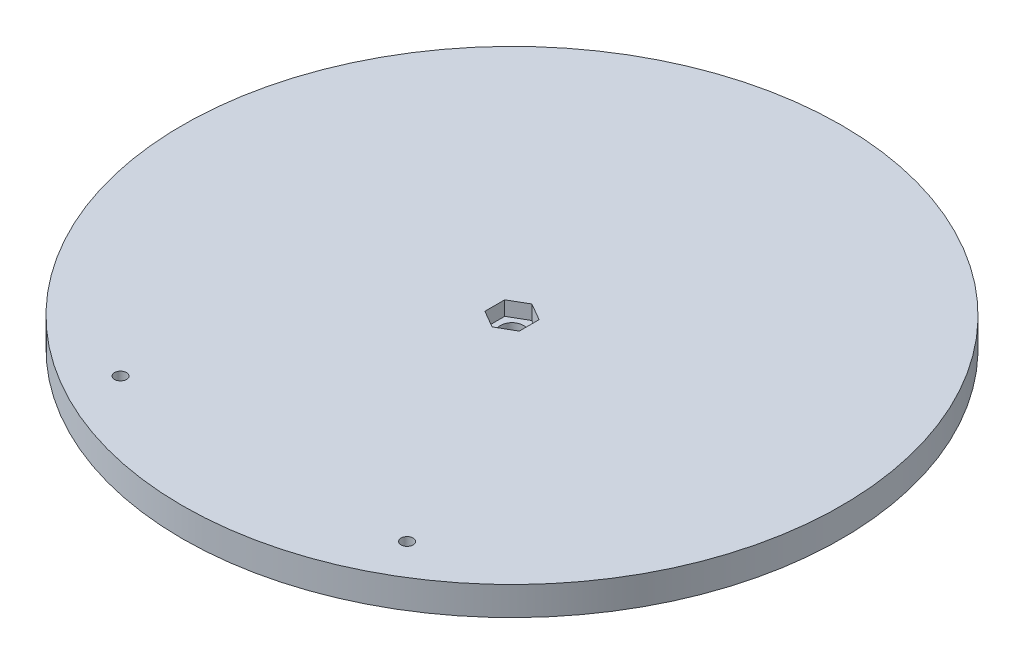
from build123d import *

# Parameters (mm, degrees)
SKETCH_2_R          = 115
EXTRUDE_2_DEPTH     = 10
EXTRUDE_3_DEPTH     = 5
CUT_EXTRUDE_2_REACH = 164.942
CUT_EXTRUDE_3_REACH = 164.942
SKETCH_4_R          = 2.1


with BuildPart() as part:
    # 草图2 → 凸台-拉伸2 (new body)
    with BuildSketch(Plane(origin=(0, 0, 0), x_dir=(1, 0, 0), z_dir=(0, 1, 0))):
        Circle(SKETCH_2_R)
        Polygon((6, 3.464101615), (6, -3.464101615), (0, -6.92820323), (-6, -3.464101615), (-6, 3.464101615), (0, 6.92820323), align=None, mode=Mode.SUBTRACT)
    extrude(amount=EXTRUDE_2_DEPTH)

    # 草图2<4> → 凸台-拉伸3 (add)
    with BuildSketch(Plane(origin=(0, 0, 0), x_dir=(1, 0, 0), z_dir=(0, 1, 0))):
        Polygon((0, -6.92820323), (6, -3.464101615), (6, 3.464101615), (0, 6.92820323), (-6, 3.464101615), (-6, -3.464101615), align=None)
    extrude(amount=EXTRUDE_3_DEPTH)

    # 草图2<6> → 切除-拉伸2 (cut, up to next)
    with BuildSketch(Plane(origin=(0, 0, 0), x_dir=(1, 0, 0), z_dir=(0, 1, 0)), mode=Mode.PRIVATE) as cut_extrude_2_sk1:
        with BuildLine():
            ThreePointArc((1.999999959, -3.464101639), (3.464101603, -2.000000021), (4, 0))
            ThreePointArc((4, 0), (3.464101628, 1.999999978), (2.000000044, 3.464101589))
            ThreePointArc((2.000000044, 3.464101589), (-1.8e-08, 4), (-2.000000076, 3.464101571))
            ThreePointArc((-2.000000076, 3.464101571), (-3.464101637, 1.999999962), (-4, 0))
            ThreePointArc((-4, 0), (-3.464101617, -1.999999997), (-2.000000006, -3.464101612))
            ThreePointArc((-2.000000006, -3.464101612), (-2.7e-08, -4), (1.999999959, -3.464101639))
        make_face()
    cut_extrude_2_tool1 = extrude(cut_extrude_2_sk1.sketch, amount=CUT_EXTRUDE_2_REACH, mode=Mode.PRIVATE) & part.part
    add(cut_extrude_2_tool1.solids().sort_by_distance((0, 0, 0))[0], mode=Mode.SUBTRACT)

    # 草图4 → 切除-拉伸3 (cut, up to next)
    with BuildSketch(Plane(origin=(0, 10, 0), x_dir=(1, 0, 0), z_dir=(0, 1, 0)), mode=Mode.PRIVATE) as cut_extrude_3_sk1:
        with Locations((-50, -86.602540378)):
            Circle(SKETCH_4_R)
    cut_extrude_3_tool1 = extrude(cut_extrude_3_sk1.sketch, amount=-CUT_EXTRUDE_3_REACH, mode=Mode.PRIVATE) & part.part
    # 草图4 → 切除-拉伸3 (cut, up to next)
    with BuildSketch(Plane(origin=(0, 10, 0), x_dir=(1, 0, 0), z_dir=(0, 1, 0)), mode=Mode.PRIVATE) as cut_extrude_3_sk2:
        with Locations((50, -86.602540378)):
            Circle(SKETCH_4_R)
    cut_extrude_3_tool2 = extrude(cut_extrude_3_sk2.sketch, amount=-CUT_EXTRUDE_3_REACH, mode=Mode.PRIVATE) & part.part
    add(cut_extrude_3_tool1.solids().sort_by_distance((-50, 10, 86.60254))[0], mode=Mode.SUBTRACT)
    add(cut_extrude_3_tool2.solids().sort_by_distance((50, 10, 86.60254))[0], mode=Mode.SUBTRACT)


solid = part.part
